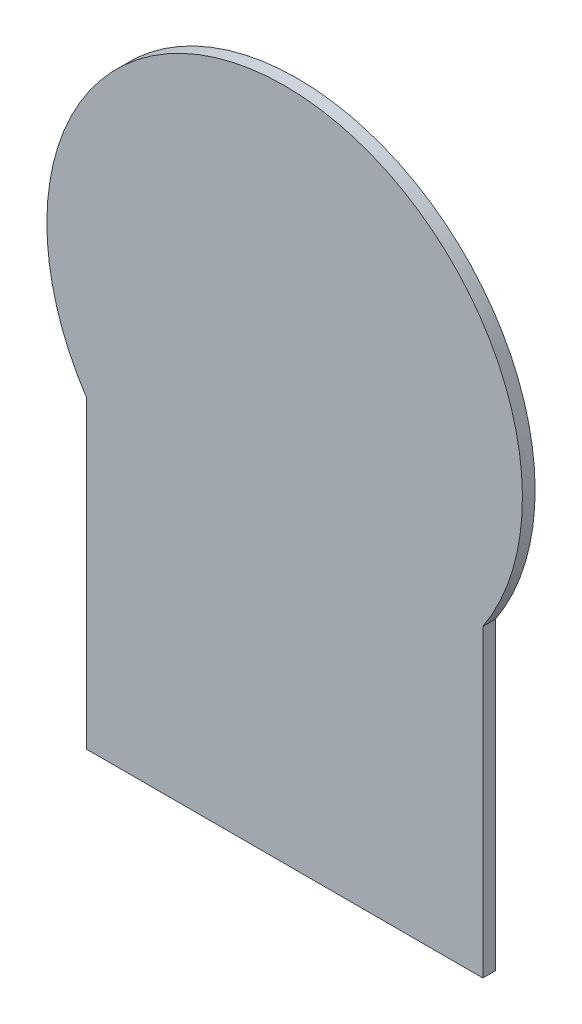
from build123d import *

# Parameters (mm, degrees)
BOSS_EXTRUDE1_DEPTH = 0.2032


with BuildPart() as part:
    # Sketch1 → Boss-Extrude1 (new body)
    with BuildSketch(Plane.XY):
        with BuildLine():
            Line((-3.175, -2.106056742), (-3.175, -6.985))
            Line((-3.175, -6.985), (3.175, -6.985))
            Line((3.175, -6.985), (3.175, -2.106056742))
            ThreePointArc((3.175, -2.106056742), (0, 3.81), (-3.175, -2.106056742))
        make_face()
    extrude(amount=BOSS_EXTRUDE1_DEPTH)


solid = part.part
